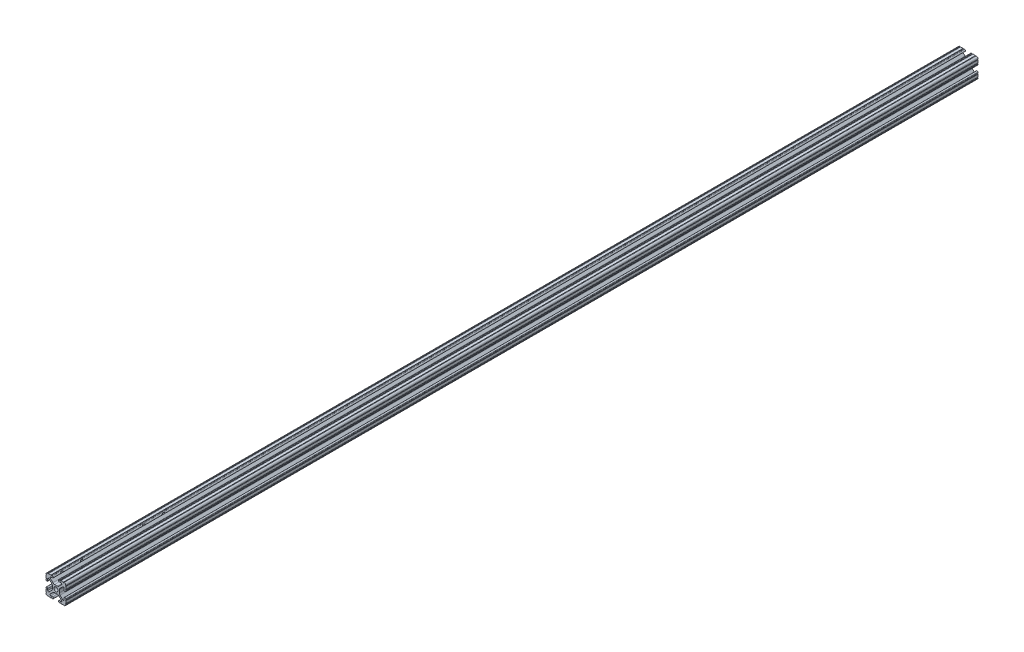
from build123d import *

# Parameters (mm, degrees)
SKETCH1_R                      = 2.6035
BOSS_EXTRUDE1_DEPTH            = 1168.4
CUT_EXTRUDE1_REACH             = 3634.263
SKETCH2_R                      = 3.7719
CUT_EXTRUDE1_DIRECTION_2_REACH = 3634.263


with BuildPart() as part:
    # Sketch1 → Boss-Extrude1 (new body)
    with BuildSketch(Plane(origin=(0, 0, -2463.8), x_dir=(-1, 0, 0), z_dir=(0, 0, -1))):
        with BuildLine():
            Line((12.7, -9.5504), (12.7, -6.3330836))
            ThreePointArc((12.7, -6.3330836), (12.192, -5.8250836), (12.7, -5.3170836))
            Line((12.7, -5.3170836), (12.7, -4.3434))
            ThreePointArc((12.7, -4.3434), (11.5951, -3.2385), (10.4902, -4.3434))
            Line((10.4902, -4.3434), (10.4902, -6.474794456))
            ThreePointArc((10.4902, -6.474794456), (9.863006367, -7.413456061), (8.75577951, -7.193214945))
            Line((8.75577951, -7.193214945), (5.42573597, -3.863171405))
            ThreePointArc((5.42573597, -3.863171405), (4.737482484, -2.833127272), (4.4958, -1.618107374))
            Line((4.4958, -1.618107374), (4.4958, 1.618107374))
            ThreePointArc((4.4958, 1.618107374), (4.737482484, 2.833127272), (5.42573597, 3.863171405))
            Line((5.42573597, 3.863171405), (8.75577951, 7.193214945))
            ThreePointArc((8.75577951, 7.193214945), (9.863006367, 7.413456061), (10.4902, 6.474794456))
            Line((10.4902, 6.474794456), (10.4902, 4.343399971))
            ThreePointArc((10.4902, 4.343399971), (11.5951, 3.238499971), (12.7, 4.343399971))
            Line((12.7, 4.343399971), (12.7, 5.3170836))
            ThreePointArc((12.7, 5.3170836), (12.192, 5.8250836), (12.7, 6.3330836))
            Line((12.7, 6.3330836), (12.7, 9.5504))
            ThreePointArc((12.7, 9.5504), (12.192000006, 10.058323491), (12.699846982, 10.566399977))
            ThreePointArc((12.699846982, 10.566399977), (12.082522516, 12.082522516), (10.566399977, 12.699846982))
            ThreePointArc((10.566399977, 12.699846982), (10.058323491, 12.192000006), (9.5504, 12.7))
            Line((9.5504, 12.7), (6.3330836, 12.7))
            ThreePointArc((6.3330836, 12.7), (5.8250836, 12.192), (5.3170836, 12.7))
            Line((5.3170836, 12.7), (4.3434, 12.7))
            ThreePointArc((4.3434, 12.7), (3.2385, 11.5951), (4.3434, 10.4902))
            Line((4.3434, 10.4902), (6.474794456, 10.4902))
            ThreePointArc((6.474794456, 10.4902), (7.413456061, 9.863006367), (7.193214945, 8.75577951))
            Line((7.193214945, 8.75577951), (3.863171405, 5.42573597))
            ThreePointArc((3.863171405, 5.42573597), (2.833127272, 4.737482484), (1.618107374, 4.4958))
            Line((1.618107374, 4.4958), (-1.618107374, 4.4958))
            ThreePointArc((-1.618107374, 4.4958), (-2.833127272, 4.737482484), (-3.863171405, 5.42573597))
            Line((-3.863171405, 5.42573597), (-7.193214945, 8.75577951))
            ThreePointArc((-7.193214945, 8.75577951), (-7.413456061, 9.863006367), (-6.474794456, 10.4902))
            Line((-6.474794456, 10.4902), (-4.343399971, 10.4902))
            ThreePointArc((-4.343399971, 10.4902), (-3.238499971, 11.5951), (-4.343399971, 12.7))
            Line((-4.343399971, 12.7), (-5.3170836, 12.7))
            ThreePointArc((-5.3170836, 12.7), (-5.8250836, 12.192), (-6.3330836, 12.7))
            Line((-6.3330836, 12.7), (-9.5504, 12.7))
            ThreePointArc((-9.5504, 12.7), (-10.058323491, 12.192000006), (-10.566399977, 12.699846982))
            ThreePointArc((-10.566399977, 12.699846982), (-12.082522516, 12.082522516), (-12.699846982, 10.566399977))
            ThreePointArc((-12.699846982, 10.566399977), (-12.192000006, 10.058323491), (-12.7, 9.5504))
            Line((-12.7, 9.5504), (-12.7, 6.3330836))
            ThreePointArc((-12.7, 6.3330836), (-12.192, 5.8250836), (-12.7, 5.3170836))
            Line((-12.7, 5.3170836), (-12.7, 4.3434))
            ThreePointArc((-12.7, 4.3434), (-11.5951, 3.2385), (-10.4902, 4.3434))
            Line((-10.4902, 4.3434), (-10.4902, 6.474794456))
            ThreePointArc((-10.4902, 6.474794456), (-9.863006367, 7.413456061), (-8.75577951, 7.193214945))
            Line((-8.75577951, 7.193214945), (-5.42573597, 3.863171405))
            ThreePointArc((-5.42573597, 3.863171405), (-4.737482484, 2.833127272), (-4.4958, 1.618107374))
            Line((-4.4958, 1.618107374), (-4.4958, -1.618107374))
            ThreePointArc((-4.4958, -1.618107374), (-4.737482484, -2.833127272), (-5.42573597, -3.863171405))
            Line((-5.42573597, -3.863171405), (-8.75577951, -7.193214945))
            ThreePointArc((-8.75577951, -7.193214945), (-9.863006367, -7.413456061), (-10.4902, -6.474794456))
            Line((-10.4902, -6.474794456), (-10.4902, -4.343399971))
            ThreePointArc((-10.4902, -4.343399971), (-11.5951, -3.238499971), (-12.7, -4.343399971))
            Line((-12.7, -4.343399971), (-12.7, -5.3170836))
            ThreePointArc((-12.7, -5.3170836), (-12.192, -5.8250836), (-12.7, -6.3330836))
            Line((-12.7, -6.3330836), (-12.7, -9.5504))
            ThreePointArc((-12.7, -9.5504), (-12.192000006, -10.058323491), (-12.699846982, -10.566399977))
            ThreePointArc((-12.699846982, -10.566399977), (-12.082522516, -12.082522516), (-10.566399977, -12.699846982))
            ThreePointArc((-10.566399977, -12.699846982), (-10.058323491, -12.192000006), (-9.5504, -12.7))
            Line((-9.5504, -12.7), (-6.3330836, -12.7))
            ThreePointArc((-6.3330836, -12.7), (-5.8250836, -12.192), (-5.3170836, -12.7))
            Line((-5.3170836, -12.7), (-4.3434, -12.7))
            ThreePointArc((-4.3434, -12.7), (-3.2385, -11.5951), (-4.3434, -10.4902))
            Line((-4.3434, -10.4902), (-6.474794456, -10.4902))
            ThreePointArc((-6.474794456, -10.4902), (-7.413456061, -9.863006367), (-7.193214945, -8.75577951))
            Line((-7.193214945, -8.75577951), (-3.863171405, -5.42573597))
            ThreePointArc((-3.863171405, -5.42573597), (-2.833127272, -4.737482484), (-1.618107374, -4.4958))
            Line((-1.618107374, -4.4958), (1.618107374, -4.4958))
            ThreePointArc((1.618107374, -4.4958), (2.833127272, -4.737482484), (3.863171405, -5.42573597))
            Line((3.863171405, -5.42573597), (7.193214945, -8.75577951))
            ThreePointArc((7.193214945, -8.75577951), (7.413456061, -9.863006367), (6.474794456, -10.4902))
            Line((6.474794456, -10.4902), (4.343399971, -10.4902))
            ThreePointArc((4.343399971, -10.4902), (3.238499971, -11.5951), (4.343399971, -12.7))
            Line((4.343399971, -12.7), (5.3170836, -12.7))
            ThreePointArc((5.3170836, -12.7), (5.8250836, -12.192), (6.3330836, -12.7))
            Line((6.3330836, -12.7), (9.5504, -12.7))
            ThreePointArc((9.5504, -12.7), (10.058323491, -12.192000006), (10.566399977, -12.699846982))
            ThreePointArc((10.566399977, -12.699846982), (12.082522516, -12.082522516), (12.699846982, -10.566399977))
            ThreePointArc((12.699846982, -10.566399977), (12.192000006, -10.058323491), (12.7, -9.5504))
        make_face()
        with Locations(Location((0, 0, 0), (0, 0, 180))):
            Circle(SKETCH1_R, mode=Mode.SUBTRACT)
    extrude(amount=BOSS_EXTRUDE1_DEPTH)

    # Cut-Extrude1: up to this face of the body (flat: up to its plane)
    cut_extrude1_end = Plane(part.part.faces().sort_by_distance((-7.9417418, -12.7, -3048))[0])
    # Sketch2 → Cut-Extrude1 (cut, up to the picked face)
    with BuildSketch(Plane(origin=(0, 4.4958, 0), x_dir=(1, 0, 0), z_dir=(0, 1, 0)), mode=Mode.PRIVATE) as cut_extrude1_sk1:
        with Locations(Location((0, 2500.3125, 0), (0, 0, 244.596520041))):
            Circle(SKETCH2_R)
    cut_extrude1_tool1 = split(extrude(cut_extrude1_sk1.sketch, amount=-CUT_EXTRUDE1_REACH, mode=Mode.PRIVATE), bisect_by=cut_extrude1_end, keep=Keep.BOTH, mode=Mode.PRIVATE)
    # Sketch2 → Cut-Extrude1 (cut, up to the picked face)
    with BuildSketch(Plane(origin=(0, 4.4958, 0), x_dir=(1, 0, 0), z_dir=(0, 1, 0)), mode=Mode.PRIVATE) as cut_extrude1_sk2:
        with Locations(Location((0, 2474.9125, 0), (0, 0, 244.596520041))):
            Circle(SKETCH2_R)
    cut_extrude1_tool2 = split(extrude(cut_extrude1_sk2.sketch, amount=-CUT_EXTRUDE1_REACH, mode=Mode.PRIVATE), bisect_by=cut_extrude1_end, keep=Keep.BOTH, mode=Mode.PRIVATE)
    # Sketch2 → Cut-Extrude1 (cut, up to the picked face)
    with BuildSketch(Plane(origin=(0, 4.4958, 0), x_dir=(1, 0, 0), z_dir=(0, 1, 0)), mode=Mode.PRIVATE) as cut_extrude1_sk3:
        with Locations(Location((0, 2605.0875, 0), (0, 0, 244.596520041))):
            Circle(SKETCH2_R)
    cut_extrude1_tool3 = split(extrude(cut_extrude1_sk3.sketch, amount=-CUT_EXTRUDE1_REACH, mode=Mode.PRIVATE), bisect_by=cut_extrude1_end, keep=Keep.BOTH, mode=Mode.PRIVATE)
    # Sketch2 → Cut-Extrude1 (cut, up to the picked face)
    with BuildSketch(Plane(origin=(0, 4.4958, 0), x_dir=(1, 0, 0), z_dir=(0, 1, 0)), mode=Mode.PRIVATE) as cut_extrude1_sk4:
        with Locations(Location((0, 2579.6875, 0), (0, 0, 244.596520041))):
            Circle(SKETCH2_R)
    cut_extrude1_tool4 = split(extrude(cut_extrude1_sk4.sketch, amount=-CUT_EXTRUDE1_REACH, mode=Mode.PRIVATE), bisect_by=cut_extrude1_end, keep=Keep.BOTH, mode=Mode.PRIVATE)
    add(cut_extrude1_tool1.solids().sort_by(Axis((0, 4.4958, -2500.3125), (0, -1, 0)))[0], mode=Mode.SUBTRACT)
    add(cut_extrude1_tool2.solids().sort_by(Axis((0, 4.4958, -2474.9125), (0, -1, 0)))[0], mode=Mode.SUBTRACT)
    add(cut_extrude1_tool3.solids().sort_by(Axis((0, 4.4958, -2605.0875), (0, -1, 0)))[0], mode=Mode.SUBTRACT)
    add(cut_extrude1_tool4.solids().sort_by(Axis((0, 4.4958, -2579.6875), (0, -1, 0)))[0], mode=Mode.SUBTRACT)

    # Cut-Extrude1 direction 2: up to this face of the body (flat: up to its plane)
    cut_extrude1_direction_2_end = Plane(part.part.faces().sort_by_distance((-7.9417418, 12.7, -3048))[0])
    # Sketch2 → Cut-Extrude1 direction 2 (cut, up to the picked face)
    with BuildSketch(Plane(origin=(0, 4.4958, 0), x_dir=(1, 0, 0), z_dir=(0, 1, 0)), mode=Mode.PRIVATE) as cut_extrude1_direction_2_sk1:
        with Locations(Location((0, 2500.3125, 0), (0, 0, 244.596520041))):
            Circle(SKETCH2_R)
    cut_extrude1_direction_2_tool1 = split(extrude(cut_extrude1_direction_2_sk1.sketch, amount=CUT_EXTRUDE1_DIRECTION_2_REACH, mode=Mode.PRIVATE), bisect_by=cut_extrude1_direction_2_end, keep=Keep.BOTH, mode=Mode.PRIVATE)
    # Sketch2 → Cut-Extrude1 direction 2 (cut, up to the picked face)
    with BuildSketch(Plane(origin=(0, 4.4958, 0), x_dir=(1, 0, 0), z_dir=(0, 1, 0)), mode=Mode.PRIVATE) as cut_extrude1_direction_2_sk2:
        with Locations(Location((0, 2474.9125, 0), (0, 0, 244.596520041))):
            Circle(SKETCH2_R)
    cut_extrude1_direction_2_tool2 = split(extrude(cut_extrude1_direction_2_sk2.sketch, amount=CUT_EXTRUDE1_DIRECTION_2_REACH, mode=Mode.PRIVATE), bisect_by=cut_extrude1_direction_2_end, keep=Keep.BOTH, mode=Mode.PRIVATE)
    # Sketch2 → Cut-Extrude1 direction 2 (cut, up to the picked face)
    with BuildSketch(Plane(origin=(0, 4.4958, 0), x_dir=(1, 0, 0), z_dir=(0, 1, 0)), mode=Mode.PRIVATE) as cut_extrude1_direction_2_sk3:
        with Locations(Location((0, 2605.0875, 0), (0, 0, 244.596520041))):
            Circle(SKETCH2_R)
    cut_extrude1_direction_2_tool3 = split(extrude(cut_extrude1_direction_2_sk3.sketch, amount=CUT_EXTRUDE1_DIRECTION_2_REACH, mode=Mode.PRIVATE), bisect_by=cut_extrude1_direction_2_end, keep=Keep.BOTH, mode=Mode.PRIVATE)
    # Sketch2 → Cut-Extrude1 direction 2 (cut, up to the picked face)
    with BuildSketch(Plane(origin=(0, 4.4958, 0), x_dir=(1, 0, 0), z_dir=(0, 1, 0)), mode=Mode.PRIVATE) as cut_extrude1_direction_2_sk4:
        with Locations(Location((0, 2579.6875, 0), (0, 0, 244.596520041))):
            Circle(SKETCH2_R)
    cut_extrude1_direction_2_tool4 = split(extrude(cut_extrude1_direction_2_sk4.sketch, amount=CUT_EXTRUDE1_DIRECTION_2_REACH, mode=Mode.PRIVATE), bisect_by=cut_extrude1_direction_2_end, keep=Keep.BOTH, mode=Mode.PRIVATE)
    add(cut_extrude1_direction_2_tool1.solids().sort_by(Axis((0, 4.4958, -2500.3125), (0, 1, 0)))[0], mode=Mode.SUBTRACT)
    add(cut_extrude1_direction_2_tool2.solids().sort_by(Axis((0, 4.4958, -2474.9125), (0, 1, 0)))[0], mode=Mode.SUBTRACT)
    add(cut_extrude1_direction_2_tool3.solids().sort_by(Axis((0, 4.4958, -2605.0875), (0, 1, 0)))[0], mode=Mode.SUBTRACT)
    add(cut_extrude1_direction_2_tool4.solids().sort_by(Axis((0, 4.4958, -2579.6875), (0, 1, 0)))[0], mode=Mode.SUBTRACT)


solid = part.part
